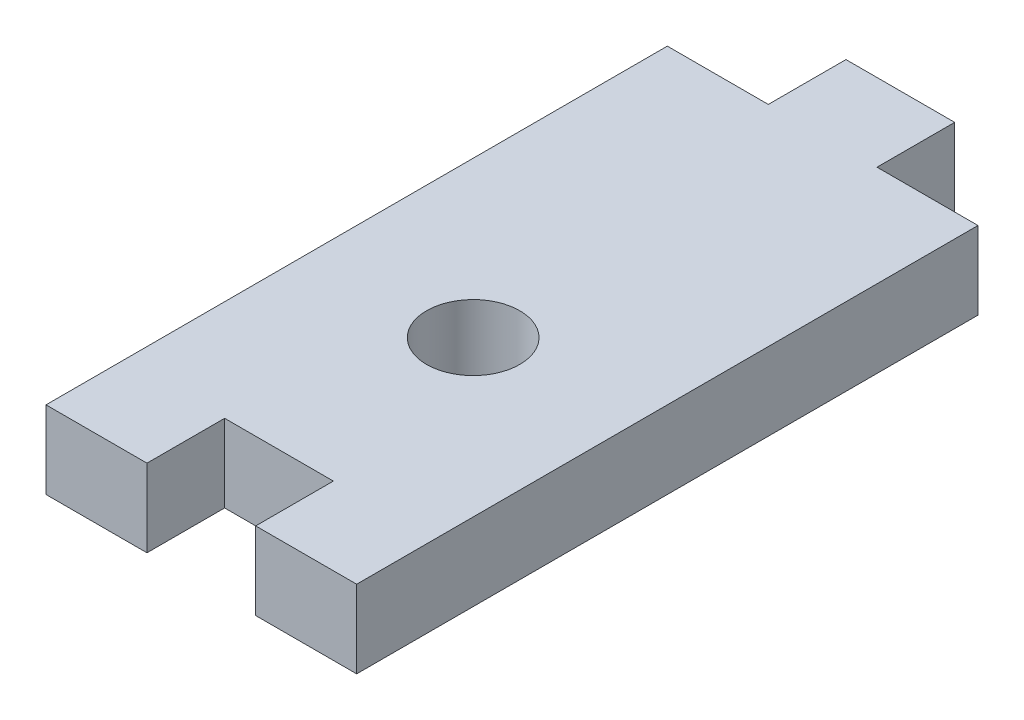
from build123d import *

# Parameters (mm, degrees)
BOSS_EXTRUDE1_DEPTH = 5
SKETCH2_R           = 3
CUT_EXTRUDE1_DEPTH  = 10


with BuildPart() as part:
    # Sketch1 → Boss-Extrude1 (new body)
    with BuildSketch(Plane(origin=(0, 0, 0), x_dir=(1, 0, 0), z_dir=(0, 1, 0))):
        Polygon((-10, 20), (-10, -20), (-3.5, -20), (-3.5, -15), (3.5, -15), (3.5, -20), (10, -20), (10, 20), (3.5, 20), (3.5, 25), (-3.5, 25), (-3.5, 20), align=None)
    extrude(amount=BOSS_EXTRUDE1_DEPTH)

    # Sketch2 → Cut-Extrude1 (cut)
    with BuildSketch(Plane(origin=(0, 5, 0), x_dir=(1, 0, 0), z_dir=(0, 1, 0))):
        with Locations(Location((0, -2.5, 0), (0, 0, 270))):
            Circle(SKETCH2_R)
    extrude(amount=-CUT_EXTRUDE1_DEPTH, mode=Mode.SUBTRACT)


solid = part.part
